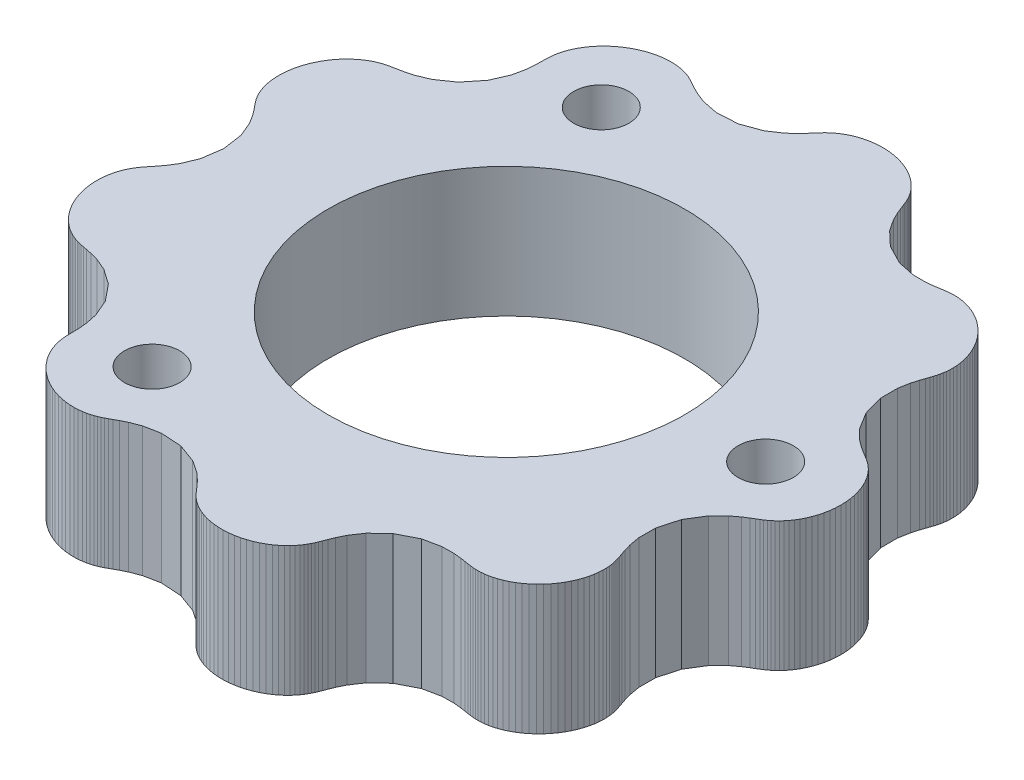
from build123d import *

# Parameters (mm, degrees)
SKETCH1_R           = 8.73125
BOSS_EXTRUDE1_DEPTH = 6.35
SKETCH2_R           = 1.35255
CUT_EXTRUDE1_DEPTH  = 25.224472388


with BuildPart() as part:
    # Sketch1 → Boss-Extrude1 (new body)
    with BuildSketch(Plane(origin=(0, 0, 0), x_dir=(1, 0, 0), z_dir=(0, 1, 0))):
        Polygon((15.113, 0), (15.1037098, 0.252373898), (15.076120221, 0.501441201), (15.031063567, 0.744002623), (14.969891178, 0.977070714), (14.894419758, 1.197968937), (14.806856213, 1.40442283), (14.709700614, 1.59464116), (14.605626127, 1.767385538), (14.497333292, 1.922027795), (14.387373453, 2.058595847), (14.277931522, 2.177811193), (14.170550195, 2.281125747), (14.065763482, 2.370774872), (13.962581974, 2.449883067), (13.857727259, 2.522703023), (13.744436765, 2.595174211), (13.610554661, 2.676248173), (13.435609261, 2.781081863), (13.187444634, 2.938707144), (12.824547299, 3.20869705), (12.33142196, 3.701119456), (11.825752552, 4.517139614), (11.553675383, 5.507522519), (11.549951229, 6.329405811), (11.647939952, 6.871575316), (11.74624054, 7.211890314), (11.822226004, 7.436755074), (11.879019129, 7.600842383), (11.923185992, 7.735713513), (11.959387998, 7.859814548), (11.989893408, 7.984239582), (12.015108835, 8.115729983), (12.03418011, 8.258247029), (12.045479981, 8.413835266), (12.046978381, 8.583130042), (12.036521503, 8.765683234), (12.012043562, 8.960194623), (11.97172789, 9.164693878), (11.914128123, 9.376696486), (11.838256205, 9.593345557), (11.743641501, 9.811545223), (11.630363854, 10.028087812), (11.49906265, 10.239774958), (11.350923638, 10.443531654), (11.187645087, 10.636511559), (11.011384949, 10.81619158), (10.824690745, 10.980453565), (10.630413974, 11.127650996), (10.431610837, 11.256658597), (10.231430953, 11.366902926), (10.032995369, 11.458372052), (9.839264445, 11.531602462), (9.652894929, 11.587641141), (9.476083235, 11.627980349), (9.310388017, 11.654461744), (9.156518117, 11.669145106), (9.014059187, 11.674134886), (8.881088355, 11.671355801), (8.753579765, 11.662269655), (8.624411353, 11.64754098), (8.481598265, 11.626730778), (8.305029539, 11.598373831), (8.06051242, 11.561787995), (7.690617555, 11.525204351), (7.112298793, 11.532000831), (6.277834761, 11.705419572), (5.357339421, 12.178683104), (4.678207585, 12.822699212), (4.307689577, 13.376311691), (4.118947956, 13.763226837), (4.012978849, 14.023633296), (3.94275084, 14.207655554), (3.887140029, 14.35024441), (3.835521722, 14.472944661), (3.781502044, 14.588492361), (3.720554495, 14.704080006), (3.649150001, 14.823350721), (3.564453863, 14.94760462), (3.464238115, 15.076556128), (3.346871833, 15.208837563), (3.211333462, 15.342356563), (3.057221601, 15.474566352), (2.884754249, 15.60268116), (2.694752474, 15.723854542), (2.488607344, 15.835330074), (2.26823045, 15.934569312), (2.035989217, 16.019359221), (1.794628791, 16.087899839), (1.547182652, 16.138872117), (1.296874426, 16.171485559), (1.04701352, 16.185505123), (0.800887329, 16.181256869), (0.561652756, 16.159611933), (0.332229658, 16.121948388), (0.115198601, 16.070090519), (-0.087295144, 16.006224691), (-0.273630146, 15.932790317), (-0.44278984, 15.852343016), (-0.594437906, 15.767384631), (-0.728993305, 15.680150359), (-0.847716571, 15.592335656), (-0.95283142, 15.504732344), (-1.047731466, 15.416720327), (-1.137378092, 15.325522626), (-1.229124041, 15.225072733), (-1.334500506, 15.104289077), (-1.473213973, 14.944696306), (-1.682009433, 14.71870051), (-2.031544533, 14.39665895), (-2.636475317, 13.99152342), (-3.558487509, 13.655052018), (-4.571898836, 13.592518006), (-5.347784749, 13.745585926), (-5.837208072, 13.934481408), (-6.139392317, 14.085369452), (-6.339283738, 14.19528883), (-6.486885727, 14.277249117), (-6.610316874, 14.342776307), (-6.725961577, 14.39921179), (-6.843805112, 14.450377905), (-6.970081471, 14.497616027), (-7.108615586, 14.540623938), (-7.26153958, 14.578063158), (-7.429704043, 14.607995761), (-7.612938279, 14.62820499), (-7.810235417, 14.6364365), (-8.01990078, 14.630583148), (-8.239683116, 14.608827162), (-8.466898433, 14.569747904), (-8.698550891, 14.512400143), (-8.931452137, 14.436365864), (-9.16233874, 14.34178159), (-9.387986337, 14.229342706), (-9.605318535, 14.10028608), (-9.811508267, 13.956352238), (-10.004069197, 13.799728452), (-10.180934773, 13.63297413), (-10.340522575, 13.458929924), (-10.481781784, 13.280611838), (-10.604221698, 13.101091225), (-10.70791936, 12.923360831), (-10.793504411, 12.750185635), (-10.862119221, 12.583934795), (-10.915352192, 12.426386684), (-10.955141952, 12.278491408), (-10.983650508, 12.14006137), (-11.003106028, 12.009334731), (-11.015626318, 11.882307569), (-11.023069784, 11.751635345), (-11.027077755, 11.604722415), (-11.029850771, 11.420309085), (-11.037403313, 11.16261426), (-11.070443698, 10.773802173), (-11.192983393, 10.17954405), (-11.541437116, 9.369632187), (-12.196298768, 8.562922822), (-12.942631248, 8.04278274), (-13.529466728, 7.797411851), (-13.924541961, 7.688536725), (-14.187856283, 7.633067269), (-14.374912719, 7.597163691), (-14.521813277, 7.567468317), (-14.650332573, 7.537717541), (-14.77333595, 7.503975603), (-14.898201181, 7.463087727), (-15.028809181, 7.412242334), (-15.166715961, 7.348905996), (-15.311876112, 7.270875491), (-15.46311957, 7.17635645), (-15.618489585, 7.064036113), (-15.77549992, 6.933138688), (-15.931342693, 6.7834596), (-16.08306375, 6.615377967), (-16.227714481, 6.429847899), (-16.362484407, 6.228369855), (-16.484816311, 6.012943637), (-16.592504206, 5.786004964), (-16.683773681, 5.550347752), (-16.757343756, 5.309034484), (-16.81246929, 5.065297189), (-16.848962949, 4.822431648), (-16.867195841, 4.583687438), (-16.868075954, 4.352156308), (-16.853003489, 4.130661098), (-16.823801907, 3.92164689), (-16.782622909, 3.727075221), (-16.731822309, 3.548320692), (-16.673801532, 3.386066872), (-16.610805534, 3.240193941), (-16.544661129, 3.109642472), (-16.476428183, 2.992222022), (-16.40591694, 2.884301388), (-16.330995207, 2.780249714), (-16.246574023, 2.671348), (-16.143171262, 2.543553637), (-16.005285879, 2.3727725), (-15.8117128, 2.11512728), (-15.547768843, 1.691205056), (-15.256921222, 0.989637368), (-15.113, 0), (-15.256921222, -0.989637368), (-15.547768843, -1.691205056), (-15.8117128, -2.11512728), (-16.005285879, -2.3727725), (-16.143171262, -2.543553637), (-16.246574023, -2.671348), (-16.330995207, -2.780249714), (-16.40591694, -2.884301388), (-16.476428183, -2.992222022), (-16.544661129, -3.109642472), (-16.610805534, -3.240193941), (-16.673801532, -3.386066872), (-16.731822309, -3.548320692), (-16.782622909, -3.727075221), (-16.823801907, -3.92164689), (-16.853003489, -4.130661098), (-16.868075954, -4.352156308), (-16.867195841, -4.583687438), (-16.848962949, -4.822431648), (-16.81246929, -5.065297189), (-16.757343756, -5.309034484), (-16.683773681, -5.550347752), (-16.592504206, -5.786004964), (-16.484816311, -6.012943637), (-16.362484407, -6.228369855), (-16.227714481, -6.429847899), (-16.08306375, -6.615377967), (-15.931342693, -6.7834596), (-15.77549992, -6.933138688), (-15.618489585, -7.064036113), (-15.46311957, -7.17635645), (-15.311876112, -7.270875491), (-15.166715961, -7.348905996), (-15.028809181, -7.412242334), (-14.898201181, -7.463087727), (-14.77333595, -7.503975603), (-14.650332573, -7.537717541), (-14.521813277, -7.567468317), (-14.374912719, -7.597163691), (-14.187856283, -7.633067269), (-13.924541961, -7.688536725), (-13.529466728, -7.797411851), (-12.942631248, -8.04278274), (-12.196298768, -8.562922822), (-11.541437116, -9.369632187), (-11.192983393, -10.17954405), (-11.070443698, -10.773802173), (-11.037403313, -11.16261426), (-11.029850771, -11.420309085), (-11.027077755, -11.604722415), (-11.023069784, -11.751635345), (-11.015626318, -11.882307569), (-11.003106028, -12.009334731), (-10.983650508, -12.14006137), (-10.955141952, -12.278491408), (-10.915352192, -12.426386684), (-10.862119221, -12.583934795), (-10.793504411, -12.750185635), (-10.70791936, -12.923360831), (-10.604221698, -13.101091225), (-10.481781784, -13.280611838), (-10.340522575, -13.458929924), (-10.180934773, -13.63297413), (-10.004069197, -13.799728452), (-9.811508267, -13.956352238), (-9.605318535, -14.10028608), (-9.387986337, -14.229342706), (-9.16233874, -14.34178159), (-8.931452137, -14.436365864), (-8.698550891, -14.512400143), (-8.466898433, -14.569747904), (-8.239683116, -14.608827162), (-8.01990078, -14.630583148), (-7.810235417, -14.6364365), (-7.612938279, -14.62820499), (-7.429704043, -14.607995761), (-7.26153958, -14.578063158), (-7.108615586, -14.540623938), (-6.970081471, -14.497616027), (-6.843805112, -14.450377905), (-6.725961577, -14.39921179), (-6.610316874, -14.342776307), (-6.486885727, -14.277249117), (-6.339283738, -14.19528883), (-6.139392317, -14.085369452), (-5.837208072, -13.934481408), (-5.347784749, -13.745585926), (-4.571898836, -13.592518006), (-3.558487509, -13.655052018), (-2.636475317, -13.99152342), (-2.031544533, -14.39665895), (-1.682009433, -14.71870051), (-1.473213973, -14.944696306), (-1.334500506, -15.104289077), (-1.229124041, -15.225072733), (-1.137378092, -15.325522626), (-1.047731466, -15.416720327), (-0.95283142, -15.504732344), (-0.847716571, -15.592335656), (-0.728993305, -15.680150359), (-0.594437906, -15.767384631), (-0.44278984, -15.852343016), (-0.273630146, -15.932790317), (-0.087295144, -16.006224691), (0.115198601, -16.070090519), (0.332229658, -16.121948388), (0.561652756, -16.159611933), (0.800887329, -16.181256869), (1.04701352, -16.185505123), (1.296874426, -16.171485559), (1.547182652, -16.138872117), (1.794628791, -16.087899839), (2.035989217, -16.019359221), (2.26823045, -15.934569312), (2.488607344, -15.835330074), (2.694752474, -15.723854542), (2.884754249, -15.60268116), (3.057221601, -15.474566352), (3.211333462, -15.342356563), (3.346871833, -15.208837563), (3.464238115, -15.076556128), (3.564453863, -14.94760462), (3.649150001, -14.823350721), (3.720554495, -14.704080006), (3.781502044, -14.588492361), (3.835521722, -14.472944661), (3.887140029, -14.35024441), (3.94275084, -14.207655554), (4.012978849, -14.023633296), (4.118947956, -13.763226837), (4.307689577, -13.376311691), (4.678207585, -12.822699212), (5.357339421, -12.178683104), (6.277834761, -11.705419572), (7.112298793, -11.532000831), (7.690617555, -11.525204351), (8.06051242, -11.561787995), (8.305029539, -11.598373831), (8.481598265, -11.626730778), (8.624411353, -11.64754098), (8.753579765, -11.662269655), (8.881088355, -11.671355801), (9.014059187, -11.674134886), (9.156518117, -11.669145106), (9.310388017, -11.654461744), (9.476083235, -11.627980349), (9.652894929, -11.587641141), (9.839264445, -11.531602462), (10.032995369, -11.458372052), (10.231430953, -11.366902926), (10.431610837, -11.256658597), (10.630413974, -11.127650996), (10.824690745, -10.980453565), (11.011384949, -10.81619158), (11.187645087, -10.636511559), (11.350923638, -10.443531654), (11.49906265, -10.239774958), (11.630363854, -10.028087812), (11.743641501, -9.811545223), (11.838256205, -9.593345557), (11.914128123, -9.376696486), (11.97172789, -9.164693878), (12.012043562, -8.960194623), (12.036521503, -8.765683234), (12.046978381, -8.583130042), (12.045479981, -8.413835266), (12.03418011, -8.258247029), (12.015108835, -8.115729983), (11.989893408, -7.984239582), (11.959387998, -7.859814548), (11.923185992, -7.735713513), (11.879019129, -7.600842383), (11.822226004, -7.436755074), (11.74624054, -7.211890314), (11.647939952, -6.871575316), (11.549951229, -6.329405811), (11.553675383, -5.507522519), (11.825752552, -4.517139614), (12.33142196, -3.701119456), (12.824547299, -3.20869705), (13.187444634, -2.938707144), (13.435609261, -2.781081863), (13.610554661, -2.676248173), (13.744436765, -2.595174211), (13.857727259, -2.522703023), (13.962581974, -2.449883067), (14.065763482, -2.370774872), (14.170550195, -2.281125747), (14.277931522, -2.177811193), (14.387373453, -2.058595847), (14.497333292, -1.922027795), (14.605626127, -1.767385538), (14.709700614, -1.59464116), (14.806856213, -1.40442283), (14.894419758, -1.197968937), (14.969891178, -0.977070714), (15.031063567, -0.744002623), (15.076120221, -0.501441201), (15.1037098, -0.252373898), align=None)
        with Locations(Location((-1.27, 0, 0), (0, 0, 270))):
            Circle(SKETCH1_R, mode=Mode.SUBTRACT)
    extrude(amount=BOSS_EXTRUDE1_DEPTH)

    # Sketch2 → Cut-Extrude1 (cut, through all)
    with BuildSketch(Plane(origin=(0, 6.35, 0), x_dir=(1, 0, 0), z_dir=(0, 1, 0))):
        with Locations(Location((11.43, 0, 0), (0, 0, 270))):
            Circle(SKETCH2_R)
        with Locations(Location((-7.62, -10.998522628, 0), (0, 0, 270))):
            Circle(SKETCH2_R)
        with Locations(Location((-7.62, 10.998522628, 0), (0, 0, 270))):
            Circle(SKETCH2_R)
    extrude(amount=-CUT_EXTRUDE1_DEPTH, mode=Mode.SUBTRACT)


solid = part.part
